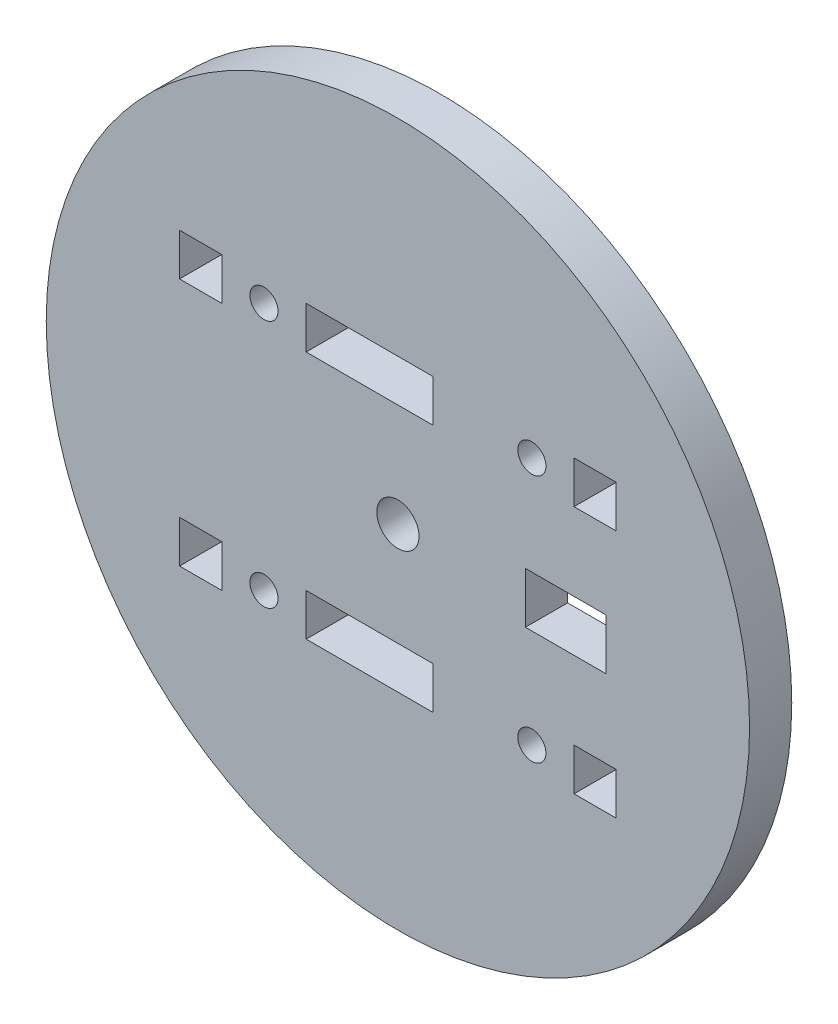
from build123d import *

# Parameters (mm, degrees)
ESQUISSE1_R             = 125
BOSS_EXTRU_1_DEPTH      = 15
ESQUISSE2_R             = 7.5
ESQUISSE2_R_2           = 5
ESQUISSE2_W             = 15
ESQUISSE2_H             = 15
ESQUISSE2_W_2           = 28.64
ESQUISSE2_H_2           = 18.12
ESQUISSE2_W_3           = 45
ENL_V_MAT_EXTRU_1_DEPTH = 178.411949992


with BuildPart() as part:
    # Esquisse1 → Boss.-Extru.1 (new body)
    with BuildSketch(Plane.XY):
        Circle(ESQUISSE1_R)
    extrude(amount=BOSS_EXTRU_1_DEPTH)

    # Esquisse2 → Enlèv. mat.-Extru.1 (cut, through all)
    with BuildSketch(Plane.XY.offset(15)):
        Circle(ESQUISSE2_R)
        with Locations((47.610253526, 44.194173824)):
            Circle(ESQUISSE2_R_2)
        with Locations((-47.610253526, 44.194173824)):
            Circle(ESQUISSE2_R_2)
        with Locations((70.110253526, 44.194173824)):
            Rectangle(ESQUISSE2_W, ESQUISSE2_H)
        with Locations((-70.110253526, 44.194173824)):
            Rectangle(ESQUISSE2_W, ESQUISSE2_H)
        with Locations((59.648339804, 0)):
            Rectangle(ESQUISSE2_W_2, ESQUISSE2_H_2)
        with Locations((-10.110253526, 44.194173824)):
            Rectangle(ESQUISSE2_W_3, ESQUISSE2_H)
    enl_v_mat_extru_1 = extrude(amount=-ENL_V_MAT_EXTRU_1_DEPTH, mode=Mode.SUBTRACT)

    # Symétrie1: Enlèv. mat.-Extru.1 across plane
    add(enl_v_mat_extru_1.mirror(Plane.ZX), mode=Mode.SUBTRACT)


solid = part.part
